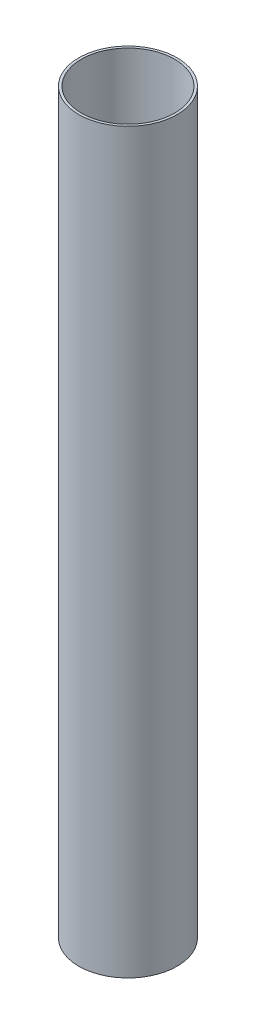
from build123d import *

# Parameters (mm, degrees)
SKETCH1_R           = 40
SKETCH1_R_2         = 38
BOSS_EXTRUDE1_DEPTH = 600


with BuildPart() as part:
    # Sketch1 → Boss-Extrude1 (new body)
    with BuildSketch(Plane(origin=(0, 0, 0), x_dir=(1, 0, 0), z_dir=(0, 1, 0))):
        with Locations(Location((0, 0, 0), (0, 0, 270))):
            Circle(SKETCH1_R)
        with Locations(Location((0, 0, 0), (0, 0, 270))):
            Circle(SKETCH1_R_2, mode=Mode.SUBTRACT)
    extrude(amount=BOSS_EXTRUDE1_DEPTH)


solid = part.part
